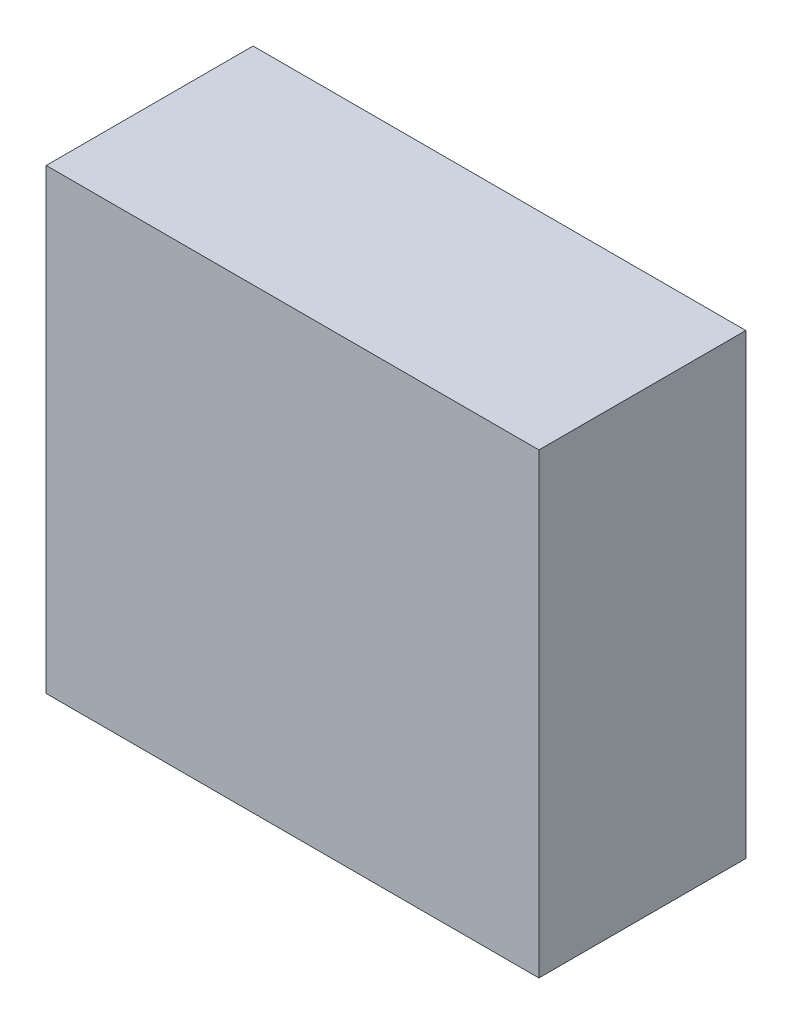
from build123d import *

# Parameters (mm, degrees)
SKETCH1_W           = 181
SKETCH1_H           = 76
BOSS_EXTRUDE1_DEPTH = 168


with BuildPart() as part:
    # Sketch1 → Boss-Extrude1 (new body)
    with BuildSketch(Plane(origin=(0, 0, 0), x_dir=(1, 0, 0), z_dir=(0, 1, 0))):
        Rectangle(SKETCH1_W, SKETCH1_H)
    extrude(amount=BOSS_EXTRUDE1_DEPTH)


solid = part.part
